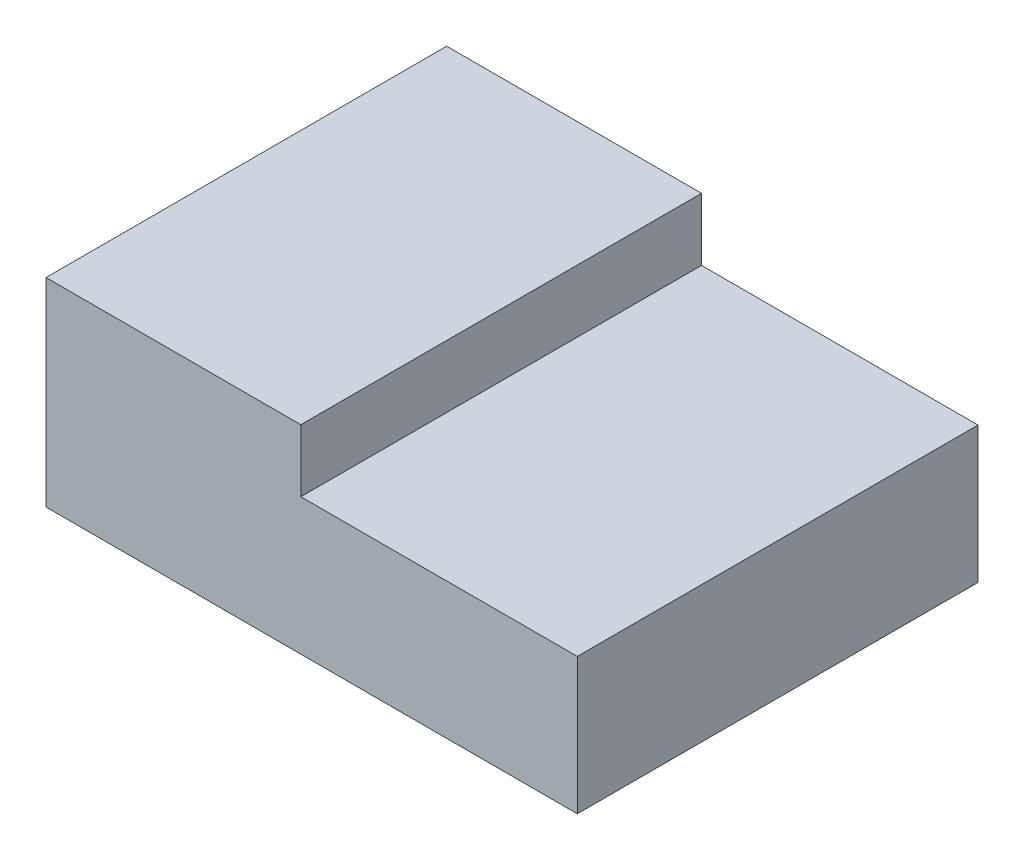
from build123d import *

# Parameters (mm, degrees)
SKETCH1_W           = 21.7
SKETCH1_H           = 31.45
BOSS_EXTRUDE1_DEPTH = 10.7
SKETCH1_4_W         = 20
SKETCH1_4_H         = 31.45
BOSS_EXTRUDE2_DEPTH = 15.6


with BuildPart() as part:
    # Sketch1 → Boss-Extrude1 (new body)
    with BuildSketch(Plane(origin=(0, 0, 0), x_dir=(1, 0, 0), z_dir=(0, 1, 0))):
        with Locations((10, 0)):
            Rectangle(SKETCH1_W, SKETCH1_H)
    extrude(amount=BOSS_EXTRUDE1_DEPTH)

    # Sketch1<4> → Boss-Extrude2 (add)
    with BuildSketch(Plane(origin=(0, 0, 0), x_dir=(1, 0, 0), z_dir=(0, 1, 0))):
        with Locations((-10.85, 0)):
            Rectangle(SKETCH1_4_W, SKETCH1_4_H)
    extrude(amount=BOSS_EXTRUDE2_DEPTH)


solid = part.part
